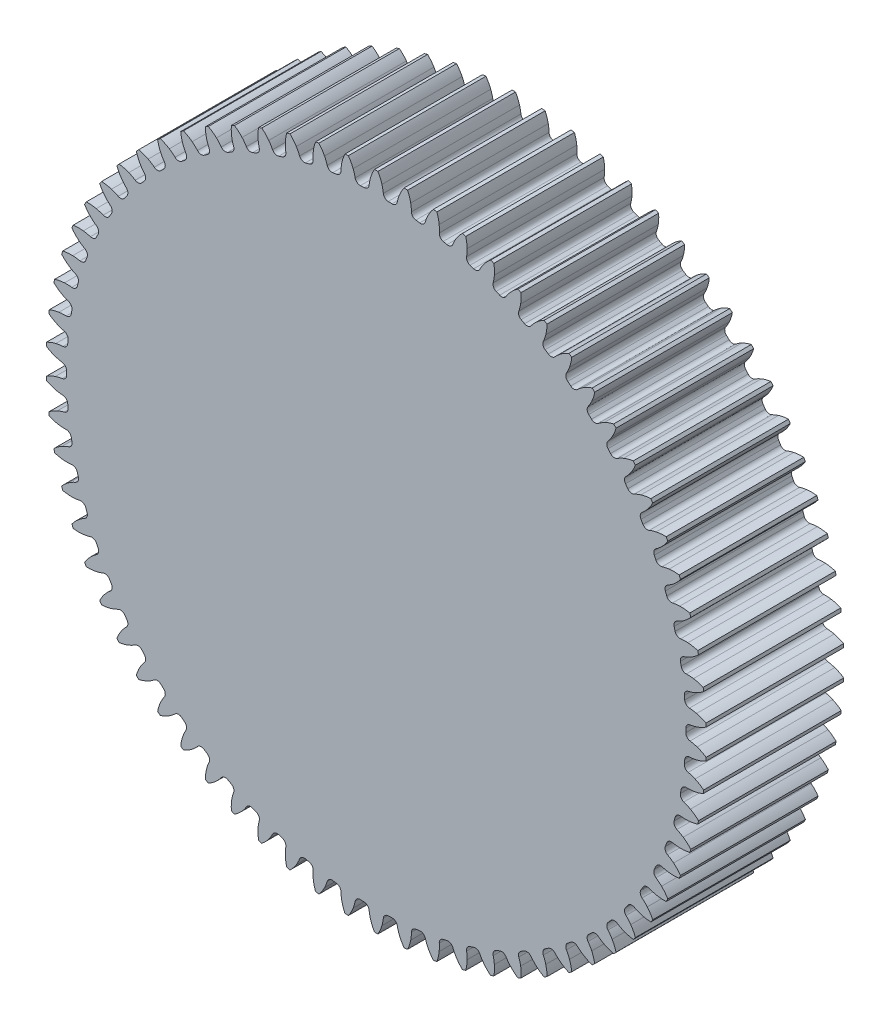
from build123d import *

# Parameters (mm, degrees)
BOSS_EXTRUDE1_DEPTH = 60


with BuildPart() as part:
    # Sketch1 → Boss-Extrude1 (new body)
    with BuildSketch(Plane.XY):
        with BuildLine():
            ThreePointArc((-5.209445207, 134.899450261), (-6.056752097, 134.864063983), (-6.903819981, 134.823355802))
            ThreePointArc((-6.903819981, 134.823355802), (-8.369677855, 135.285991471), (-9.17486238, 136.595361148))
            ThreePointArc((-9.17486238, 136.595361148), (-9.549319529, 138.136218892), (-10.057566475, 139.63826609))
            ThreePointArc((-10.057566475, 139.63826609), (-10.983932114, 141.630428056), (-12.160904684, 143.485582542))
            ThreePointArc((-12.160904684, 143.485582542), (-12.908060482, 143.420298335), (-13.654866125, 143.351123578))
            ThreePointArc((-13.654866125, 143.351123578), (-14.481673637, 141.315625621), (-15.037437945, 139.190069545))
            ThreePointArc((-15.037437945, 139.190069545), (-15.269316269, 137.621409867), (-15.362624964, 136.038452436))
            ThreePointArc((-15.362624964, 136.038452436), (-15.921072858, 134.60635362), (-17.280767005, 133.889413666))
            ThreePointArc((-17.280767005, 133.889413666), (-18.121490885, 133.778217839), (-18.96149967, 133.661742957))
            ThreePointArc((-18.96149967, 133.661742957), (-20.462926773, 133.991117704), (-21.382240854, 135.22304006))
            ThreePointArc((-21.382240854, 135.22304006), (-21.893311972, 136.724128683), (-22.534155338, 138.174570176))
            ThreePointArc((-22.534155338, 138.174570176), (-23.635367723, 140.075673508), (-24.973896913, 141.817856679))
            ThreePointArc((-24.973896913, 141.817856679), (-25.712192851, 141.685860758), (-26.449791296, 141.550021337))
            ThreePointArc((-26.449791296, 141.550021337), (-27.090809694, 139.448603242), (-27.453803281, 137.281785702))
            ThreePointArc((-27.453803281, 137.281785702), (-27.544134561, 135.698655574), (-27.495172413, 134.113706536))
            ThreePointArc((-27.495172413, 134.113706536), (-27.922999812, 132.637314046), (-29.212954228, 131.801378237))
            ThreePointArc((-29.212954228, 131.801378237), (-30.040326084, 131.615268145), (-30.866512512, 131.42396435))
            ThreePointArc((-30.866512512, 131.42396435), (-32.391420236, 131.617426243), (-33.417462097, 132.761982562))
            ThreePointArc((-33.417462097, 132.761982562), (-34.061032341, 134.211216182), (-34.829312432, 135.598373868))
            ThreePointArc((-34.829312432, 135.598373868), (-36.096505248, 137.393111999), (-37.585814009, 139.008296822))
            ThreePointArc((-37.585814009, 139.008296822), (-38.309305762, 138.81065194), (-39.0317583, 138.609241553))
            ThreePointArc((-39.0317583, 138.609241553), (-39.481826481, 136.458822704), (-39.649126735, 134.26818964))
            ThreePointArc((-39.649126735, 134.26818964), (-39.597183678, 132.683335495), (-39.4063449, 131.109155929))
            ThreePointArc((-39.4063449, 131.109155929), (-39.70010719, 129.600356809), (-40.90993592, 128.65215561))
            ThreePointArc((-40.90993592, 128.65215561), (-41.717294241, 128.3926297), (-42.523006345, 128.128037257))
            ThreePointArc((-42.523006345, 128.128037257), (-44.059117029, 128.184028656), (-45.183625585, 129.232003644))
            ThreePointArc((-45.183625585, 129.232003644), (-45.954513304, 130.617713884), (-46.844044381, 131.930419184))
            ThreePointArc((-46.844044381, 131.930419184), (-48.267014938, 133.604341939), (-49.895112231, 135.079523894))
            ThreePointArc((-49.895112231, 135.079523894), (-50.597974668, 134.817821372), (-51.299464537, 134.552461658))
            ThreePointArc((-51.299464537, 134.552461658), (-51.554958816, 132.370355962), (-51.525218735, 130.173545063))
            ThreePointArc((-51.525218735, 130.173545063), (-51.331419555, 128.599727215), (-51.00024067, 127.04899149))
            ThreePointArc((-51.00024067, 127.04899149), (-51.157572648, 125.519933702), (-52.277534863, 124.467101471))
            ThreePointArc((-52.277534863, 124.467101471), (-53.058379273, 124.136249294), (-53.837129934, 123.800498547))
            ThreePointArc((-53.837129934, 123.800498547), (-55.372075718, 123.718568641), (-56.585997087, 124.66152462))
            ThreePointArc((-56.585997087, 124.66152462), (-57.477995547, 125.972554555), (-58.48161563, 127.200238338))
            ThreePointArc((-58.48161563, 127.200238338), (-60.048907004, 128.739868276), (-61.802684347, 130.063170066))
            ThreePointArc((-61.802684347, 130.063170066), (-62.479258433, 129.739516978), (-63.154137649, 129.412344457))
            ThreePointArc((-63.154137649, 129.412344457), (-63.213000937, 127.216120946), (-62.986459969, 125.030819643))
            ThreePointArc((-62.986459969, 125.030819643), (-62.652365023, 123.480709547), (-62.183512488, 121.965903274))
            ThreePointArc((-62.183512488, 121.965903274), (-62.203147411, 120.428897894), (-63.224225834, 119.279911417))
            ThreePointArc((-63.224225834, 119.279911417), (-63.972269434, 118.880396801), (-64.717788608, 118.476191016))
            ThreePointArc((-64.717788608, 118.476191016), (-66.239211012, 118.256999456), (-67.532771413, 119.087344299))
            ThreePointArc((-67.532771413, 119.087344299), (-68.538698766, 120.313138288), (-69.648327295, 121.445915967))
            ThreePointArc((-69.648327295, 121.445915967), (-71.347320579, 122.838856891), (-73.212657588, 123.999624068))
            ThreePointArc((-73.212657588, 123.999624068), (-73.857495946, 123.616626279), (-74.500330778, 123.230275151))
            ThreePointArc((-74.500330778, 123.230275151), (-74.362089142, 121.037616526), (-73.940571263, 118.88141958))
            ThreePointArc((-73.940571263, 118.88141958), (-73.468870488, 117.367497811), (-72.866119228, 115.90081732))
            ThreePointArc((-72.866119228, 115.90081732), (-72.747899006, 114.368239411), (-73.661872514, 113.132349652))
            ThreePointArc((-73.661872514, 113.132349652), (-74.371092496, 112.667389252), (-75.077377702, 112.197982858))
            ThreePointArc((-75.077377702, 112.197982858), (-76.573027126, 111.843294446), (-77.935811571, 112.554342704))
            ThreePointArc((-77.935811571, 112.554342704), (-79.047568683, 113.685031374), (-80.254271582, 114.713782488))
            ThreePointArc((-80.254271582, 114.713782488), (-82.07128748, 115.948819258), (-84.033165558, 116.937706007))
            ThreePointArc((-84.033165558, 116.937706007), (-84.64107633, 116.49844719), (-85.24669105, 116.056028129))
            ThreePointArc((-85.24669105, 116.056028129), (-84.91245753, 113.884588387), (-84.299356554, 111.774856227))
            ThreePointArc((-84.299356554, 111.774856227), (-83.693847806, 110.309311994), (-82.96205082, 108.902566134))
            ThreePointArc((-82.96205082, 108.902566134), (-82.706927294, 107.386755112), (-83.506437109, 106.073912728))
            ThreePointArc((-83.506437109, 106.073912728), (-84.171123251, 105.547250133), (-84.832487896, 105.016422513))
            ThreePointArc((-84.832487896, 105.016422513), (-86.290322251, 104.529092992), (-87.711358401, 105.115119723))
            ThreePointArc((-87.711358401, 105.115119723), (-88.919994056, 106.141599433), (-90.214055663, 107.058041084))
            ThreePointArc((-90.214055663, 107.058041084), (-92.134464632, 108.125229909), (-94.177087891, 108.934274296))
            ThreePointArc((-94.177087891, 108.934274296), (-94.743176535, 108.442291105), (-95.30669509, 107.947366207))
            ThreePointArc((-95.30669509, 107.947366207), (-94.779160738, 105.814628506), (-93.979412993, 103.768347454))
            ThreePointArc((-93.979412993, 103.768347454), (-93.244971473, 102.362980457), (-92.39002076, 101.027495519))
            ThreePointArc((-92.39002076, 101.027495519), (-92.000048034, 99.540655803), (-92.678656973, 98.161431029))
            ThreePointArc((-92.678656973, 98.161431029), (-93.293457613, 97.577306617), (-93.904576777, 96.989331683))
            ThreePointArc((-93.904576777, 96.989331683), (-95.312858439, 96.373284743), (-96.780704946, 96.829571604))
            ThreePointArc((-96.780704946, 96.829571604), (-98.076487921, 97.743577744), (-99.447489213, 98.540331282))
            ThreePointArc((-99.447489213, 98.540331282), (-101.455829249, 99.431079786), (-103.562751686, 100.053767861))
            ThreePointArc((-103.562751686, 100.053767861), (-104.082460391, 99.513021454), (-104.59934566, 98.969575565))
            ThreePointArc((-104.59934566, 98.969575565), (-103.882757873, 96.892711453), (-102.902802458, 94.926356963))
            ThreePointArc((-102.902802458, 94.926356963), (-102.045341457, 93.592482391), (-101.074120578, 92.339010913))
            ThreePointArc((-101.074120578, 92.339010913), (-100.552438482, 90.893113662), (-101.104682786, 89.458611205))
            ThreePointArc((-101.104682786, 89.458611205), (-101.66464791, 88.821728002), (-102.220601222, 88.181339783))
            ThreePointArc((-102.220601222, 88.181339783), (-103.567991533, 87.441535471), (-105.070830161, 87.76440871))
            ThreePointArc((-105.070830161, 87.76440871), (-106.443327574, 88.558582239), (-107.880230054, 89.229232674))
            ThreePointArc((-107.880230054, 89.229232674), (-109.960331183, 89.936369073), (-112.114589099, 90.367687318))
            ThreePointArc((-112.114589099, 90.367687318), (-112.583733475, 89.782531468), (-113.049823802, 89.194940094))
            ThreePointArc((-113.049823802, 89.194940094), (-112.149952123, 87.19067126), (-110.997679063, 85.320075261))
            ThreePointArc((-110.997679063, 85.320075261), (-110.024102354, 84.068432687), (-108.944431006, 82.907066886))
            ThreePointArc((-108.944431006, 82.907066886), (-108.295239819, 81.513753615), (-108.716673141, 80.035523245))
            ThreePointArc((-108.716673141, 80.035523245), (-109.217294241, 79.351009059), (-109.71360549, 78.663363584))
            ThreePointArc((-109.71360549, 78.663363584), (-110.989256057, 77.805758371), (-112.514986832, 77.992618401))
            ThreePointArc((-112.514986832, 77.992618401), (-113.95314814, 78.660565102), (-115.444382715, 79.19971275))
            ThreePointArc((-115.444382715, 79.19971275), (-117.579497187, 79.717543598), (-119.763745763, 79.954019291))
            ThreePointArc((-119.763745763, 79.954019291), (-120.178548536, 79.329165329), (-120.590091235, 78.702159411))
            ThreePointArc((-120.590091235, 78.702159411), (-119.514180902, 76.78662305), (-118.198867622, 75.026846481))
            ThreePointArc((-118.198867622, 75.026846481), (-117.117013871, 73.867513395), (-115.937584935, 72.807603905))
            ThreePointArc((-115.937584935, 72.807603905), (-115.166111562, 71.478092752), (-115.453340769, 69.968036312))
            ThreePointArc((-115.453340769, 69.968036312), (-115.890587136, 69.24140245), (-116.323260317, 68.512036236))
            ThreePointArc((-116.323260317, 68.512036236), (-117.516900351, 67.543535054), (-119.053238987, 67.592877388))
            ThreePointArc((-119.053238987, 67.592877388), (-120.545484961, 68.129219346), (-122.079045086, 68.532523307))
            ThreePointArc((-122.079045086, 68.532523307), (-124.251982214, 68.856879335), (-126.448635166, 68.896608514))
            ThreePointArc((-126.448635166, 68.896608514), (-126.805756587, 68.237087396), (-127.159438159, 67.575715216))
            ThreePointArc((-127.159438159, 67.575715216), (-125.916151769, 65.7643341), (-124.448388399, 64.129545648))
            ThreePointArc((-124.448388399, 64.129545648), (-123.266968056, 63.071856319), (-121.9972776, 62.121936907))
            ThreePointArc((-121.9972776, 62.121936907), (-121.109733491, 60.866932316), (-121.260445982, 59.337207891))
            ThreePointArc((-121.260445982, 59.337207891), (-121.630797167, 58.574304781), (-121.996348649, 57.809090256))
            ThreePointArc((-121.996348649, 57.809090256), (-123.098367663, 56.737490908), (-124.632944464, 56.64891827))
            ThreePointArc((-124.632944464, 56.64891827), (-126.167260417, 57.049337175), (-127.730798768, 57.313550283))
            ThreePointArc((-127.730798768, 57.313550283), (-129.92406334, 57.441819967), (-132.115434509, 57.284482755))
            ThreePointArc((-132.115434509, 57.284482755), (-132.411999247, 56.595604558), (-132.704972056, 55.905191097))
            ThreePointArc((-132.704972056, 55.905191097), (-131.30431982, 54.212549401), (-129.695923926, 52.715911421))
            ThreePointArc((-129.695923926, 52.715911421), (-128.424449094, 51.768381741), (-127.074719919, 50.9361006))
            ThreePointArc((-127.074719919, 50.9361006), (-126.078251058, 49.765707129), (-126.091233384, 48.228631162))
            ThreePointArc((-126.091233384, 48.228631162), (-126.391707536, 47.435601251), (-126.687194115, 46.640699472))
            ThreePointArc((-126.687194115, 46.640699472), (-127.688719299, 45.474629845), (-129.209178755, 45.248855371))
            ThreePointArc((-129.209178755, 45.248855371), (-130.773211277, 45.510127286), (-132.354139163, 45.633122252))
            ThreePointArc((-132.354139163, 45.633122252), (-134.550072302, 45.56427284), (-136.718518056, 45.211136024))
            ThreePointArc((-136.718518056, 45.211136024), (-136.952138347, 44.49844719), (-137.182043547, 43.78455125))
            ThreePointArc((-137.182043547, 43.78455125), (-135.635302694, 42.224277131), (-133.899224135, 40.877839671))
            ThreePointArc((-133.899224135, 40.877839671), (-132.547931981, 40.048098593), (-131.129031312, 39.340156761))
            ThreePointArc((-131.129031312, 39.340156761), (-130.031660679, 38.26379773), (-129.906808315, 36.731745852))
            ThreePointArc((-129.906808315, 36.731745852), (-130.134986194, 35.914974152), (-130.358028784, 35.096785201))
            ThreePointArc((-130.358028784, 35.096785201), (-131.250996447, 33.845633802), (-132.745096712, 33.484475295))
            ThreePointArc((-132.745096712, 33.484475295), (-134.326253133, 33.604496612), (-135.911841852, 33.585283153))
            ThreePointArc((-135.911841852, 33.585283153), (-138.092763196, 33.319868979), (-140.220824485, 32.77377581))
            ThreePointArc((-140.220824485, 32.77377581), (-140.389619354, 32.04301449), (-140.554605886, 31.311383941))
            ThreePointArc((-140.554605886, 31.311383941), (-138.874229862, 29.896039808), (-137.024446521, 28.710643592))
            ThreePointArc((-137.024446521, 28.710643592), (-135.604216856, 28.005371702), (-134.127568848, 27.427469112))
            ThreePointArc((-134.127568848, 27.427469112), (-132.938131827, 26.453810731), (-132.67645001, 24.939118123))
            ThreePointArc((-132.67645001, 24.939118123), (-132.830494461, 24.105180798), (-132.979297255, 23.270292252))
            ThreePointArc((-132.979297255, 23.270292252), (-133.756517746, 21.944132616), (-135.212229204, 21.450497912))
            ThreePointArc((-135.212229204, 21.450497912), (-136.797778981, 21.428302289), (-138.375262305, 21.267035102))
            ThreePointArc((-138.375262305, 21.267035102), (-140.523612358, 20.807193125), (-142.594155283, 20.072540423))
            ThreePointArc((-142.594155283, 20.072540423), (-142.696765695, 19.329590278), (-142.795505182, 18.58611578))
            ThreePointArc((-142.795505182, 18.58611578), (-140.995023388, 17.327097152), (-139.046428634, 16.312286293))
            ThreePointArc((-139.046428634, 16.312286293), (-137.568696311, 15.737162026), (-136.046190065, 15.293951609))
            ThreePointArc((-136.046190065, 15.293951609), (-134.774263303, 14.430833203), (-134.377858942, 12.945695279))
            ThreePointArc((-134.377858942, 12.945695279), (-134.456529689, 12.101306702), (-134.529894615, 11.256440592))
            ThreePointArc((-134.529894615, 11.256440592), (-135.185110211, 9.865950178), (-136.590712329, 9.243813733))
            ThreePointArc((-136.590712329, 9.243813733), (-138.167889549, 9.079579877), (-139.72456651, 8.777557388))
            ThreePointArc((-139.72456651, 8.777557388), (-141.82304802, 8.126989986), (-143.819401788, 7.209692743))
            ThreePointArc((-143.819401788, 7.209692743), (-143.855001582, 6.46053557), (-143.886699033, 5.711203143))
            ThreePointArc((-143.886699033, 5.711203143), (-141.98060789, 4.618646898), (-139.948890661, 3.782592056))
            ThreePointArc((-139.948890661, 3.782592056), (-138.425553512, 3.342245974), (-136.869447353, 3.037296199))
            ThreePointArc((-136.869447353, 3.037296199), (-135.525271657, 2.29166709), (-134.997336366, 0.848041308))
            ThreePointArc((-134.997336366, 0.848041308), (-135, 0), (-134.997336366, -0.848041308))
            ThreePointArc((-134.997336366, -0.848041308), (-135.525271657, -2.29166709), (-136.869447353, -3.037296199))
            ThreePointArc((-136.869447353, -3.037296199), (-138.425553512, -3.342245974), (-139.948890661, -3.782592056))
            ThreePointArc((-139.948890661, -3.782592056), (-141.98060789, -4.618646898), (-143.886699033, -5.711203143))
            ThreePointArc((-143.886699033, -5.711203143), (-143.855001582, -6.46053557), (-143.819401788, -7.209692743))
            ThreePointArc((-143.819401788, -7.209692743), (-141.82304802, -8.126989986), (-139.72456651, -8.777557388))
            ThreePointArc((-139.72456651, -8.777557388), (-138.167889549, -9.079579877), (-136.590712329, -9.243813733))
            ThreePointArc((-136.590712329, -9.243813733), (-135.185110211, -9.865950178), (-134.529894615, -11.256440592))
            ThreePointArc((-134.529894615, -11.256440592), (-134.456529689, -12.101306702), (-134.377858942, -12.945695279))
            ThreePointArc((-134.377858942, -12.945695279), (-134.774263303, -14.430833203), (-136.046190065, -15.293951609))
            ThreePointArc((-136.046190065, -15.293951609), (-137.568696311, -15.737162026), (-139.046428634, -16.312286293))
            ThreePointArc((-139.046428634, -16.312286293), (-140.995023388, -17.327097152), (-142.795505182, -18.58611578))
            ThreePointArc((-142.795505182, -18.58611578), (-142.696765695, -19.329590278), (-142.594155283, -20.072540423))
            ThreePointArc((-142.594155283, -20.072540423), (-140.523612358, -20.807193125), (-138.375262305, -21.267035102))
            ThreePointArc((-138.375262305, -21.267035102), (-136.797778981, -21.428302289), (-135.212229204, -21.450497912))
            ThreePointArc((-135.212229204, -21.450497912), (-133.756517746, -21.944132616), (-132.979297255, -23.270292252))
            ThreePointArc((-132.979297255, -23.270292252), (-132.830494461, -24.105180798), (-132.67645001, -24.939118123))
            ThreePointArc((-132.67645001, -24.939118123), (-132.938131827, -26.453810731), (-134.127568848, -27.427469112))
            ThreePointArc((-134.127568848, -27.427469112), (-135.604216856, -28.005371702), (-137.024446521, -28.710643592))
            ThreePointArc((-137.024446521, -28.710643592), (-138.874229862, -29.896039808), (-140.554605886, -31.311383941))
            ThreePointArc((-140.554605886, -31.311383941), (-140.389619354, -32.04301449), (-140.220824485, -32.77377581))
            ThreePointArc((-140.220824485, -32.77377581), (-138.092763196, -33.319868979), (-135.911841852, -33.585283153))
            ThreePointArc((-135.911841852, -33.585283153), (-134.326253133, -33.604496612), (-132.745096712, -33.484475295))
            ThreePointArc((-132.745096712, -33.484475295), (-131.250996447, -33.845633802), (-130.358028784, -35.096785201))
            ThreePointArc((-130.358028784, -35.096785201), (-130.134986194, -35.914974151), (-129.906808315, -36.731745852))
            ThreePointArc((-129.906808315, -36.731745852), (-130.031660679, -38.26379773), (-131.129031312, -39.340156761))
            ThreePointArc((-131.129031312, -39.340156761), (-132.547931981, -40.048098593), (-133.899224135, -40.877839671))
            ThreePointArc((-133.899224135, -40.877839671), (-135.635302694, -42.224277131), (-137.182043547, -43.78455125))
            ThreePointArc((-137.182043547, -43.78455125), (-136.952138347, -44.49844719), (-136.718518056, -45.211136024))
            ThreePointArc((-136.718518056, -45.211136024), (-134.550072302, -45.56427284), (-132.354139163, -45.633122252))
            ThreePointArc((-132.354139163, -45.633122252), (-130.773211277, -45.510127286), (-129.209178755, -45.248855371))
            ThreePointArc((-129.209178755, -45.248855371), (-127.688719299, -45.474629845), (-126.687194115, -46.640699472))
            ThreePointArc((-126.687194115, -46.640699472), (-126.391707536, -47.435601251), (-126.091233384, -48.228631162))
            ThreePointArc((-126.091233384, -48.228631162), (-126.078251058, -49.765707129), (-127.074719919, -50.9361006))
            ThreePointArc((-127.074719919, -50.9361006), (-128.424449094, -51.768381741), (-129.695923926, -52.715911421))
            ThreePointArc((-129.695923926, -52.715911421), (-131.30431982, -54.212549401), (-132.704972056, -55.905191097))
            ThreePointArc((-132.704972056, -55.905191097), (-132.411999247, -56.595604558), (-132.115434509, -57.284482755))
            ThreePointArc((-132.115434509, -57.284482755), (-129.92406334, -57.441819967), (-127.730798768, -57.313550283))
            ThreePointArc((-127.730798768, -57.313550283), (-126.167260417, -57.049337175), (-124.632944464, -56.64891827))
            ThreePointArc((-124.632944464, -56.64891827), (-123.098367663, -56.737490908), (-121.996348649, -57.809090256))
            ThreePointArc((-121.996348649, -57.809090256), (-121.630797167, -58.574304781), (-121.260445982, -59.337207891))
            ThreePointArc((-121.260445982, -59.337207891), (-121.109733491, -60.866932315), (-121.9972776, -62.121936907))
            ThreePointArc((-121.9972776, -62.121936907), (-123.266968056, -63.071856319), (-124.448388399, -64.129545648))
            ThreePointArc((-124.448388399, -64.129545648), (-125.916151769, -65.7643341), (-127.159438159, -67.575715216))
            ThreePointArc((-127.159438159, -67.575715216), (-126.805756587, -68.237087396), (-126.448635166, -68.896608514))
            ThreePointArc((-126.448635166, -68.896608514), (-124.251982214, -68.856879335), (-122.079045086, -68.532523307))
            ThreePointArc((-122.079045086, -68.532523307), (-120.545484961, -68.129219346), (-119.053238987, -67.592877388))
            ThreePointArc((-119.053238987, -67.592877388), (-117.516900351, -67.543535054), (-116.323260317, -68.512036236))
            ThreePointArc((-116.323260317, -68.512036236), (-115.890587136, -69.24140245), (-115.453340769, -69.968036312))
            ThreePointArc((-115.453340769, -69.968036312), (-115.166111562, -71.478092752), (-115.937584935, -72.807603904))
            ThreePointArc((-115.937584935, -72.807603904), (-117.117013871, -73.867513395), (-118.198867622, -75.026846481))
            ThreePointArc((-118.198867622, -75.026846481), (-119.514180902, -76.78662305), (-120.590091235, -78.702159411))
            ThreePointArc((-120.590091235, -78.702159411), (-120.178548536, -79.329165329), (-119.763745763, -79.954019291))
            ThreePointArc((-119.763745763, -79.954019291), (-117.579497187, -79.717543598), (-115.444382715, -79.19971275))
            ThreePointArc((-115.444382715, -79.19971275), (-113.95314814, -78.660565102), (-112.514986832, -77.992618401))
            ThreePointArc((-112.514986832, -77.992618401), (-110.989256057, -77.805758371), (-109.71360549, -78.663363584))
            ThreePointArc((-109.71360549, -78.663363584), (-109.217294241, -79.351009059), (-108.716673141, -80.035523245))
            ThreePointArc((-108.716673141, -80.035523245), (-108.295239819, -81.513753615), (-108.944431006, -82.907066886))
            ThreePointArc((-108.944431006, -82.907066886), (-110.024102354, -84.068432687), (-110.997679063, -85.320075261))
            ThreePointArc((-110.997679063, -85.320075261), (-112.149952123, -87.19067126), (-113.049823802, -89.194940094))
            ThreePointArc((-113.049823802, -89.194940094), (-112.583733475, -89.782531468), (-112.114589099, -90.367687318))
            ThreePointArc((-112.114589099, -90.367687318), (-109.960331183, -89.936369073), (-107.880230054, -89.229232674))
            ThreePointArc((-107.880230054, -89.229232674), (-106.443327574, -88.558582239), (-105.070830161, -87.76440871))
            ThreePointArc((-105.070830161, -87.76440871), (-103.567991533, -87.441535471), (-102.220601222, -88.181339783))
            ThreePointArc((-102.220601222, -88.181339783), (-101.66464791, -88.821728002), (-101.104682786, -89.458611205))
            ThreePointArc((-101.104682786, -89.458611205), (-100.552438482, -90.893113662), (-101.074120578, -92.339010913))
            ThreePointArc((-101.074120578, -92.339010913), (-102.045341457, -93.592482391), (-102.902802458, -94.926356963))
            ThreePointArc((-102.902802458, -94.926356963), (-103.882757873, -96.892711453), (-104.59934566, -98.969575565))
            ThreePointArc((-104.59934566, -98.969575565), (-104.082460391, -99.513021454), (-103.562751686, -100.053767861))
            ThreePointArc((-103.562751686, -100.053767861), (-101.455829249, -99.431079786), (-99.447489213, -98.540331282))
            ThreePointArc((-99.447489213, -98.540331282), (-98.076487921, -97.743577744), (-96.780704946, -96.829571604))
            ThreePointArc((-96.780704946, -96.829571604), (-95.312858439, -96.373284743), (-93.904576777, -96.989331683))
            ThreePointArc((-93.904576777, -96.989331683), (-93.293457613, -97.577306617), (-92.678656973, -98.161431029))
            ThreePointArc((-92.678656973, -98.161431029), (-92.000048034, -99.540655803), (-92.39002076, -101.027495519))
            ThreePointArc((-92.39002076, -101.027495519), (-93.244971473, -102.362980457), (-93.979412993, -103.768347454))
            ThreePointArc((-93.979412993, -103.768347454), (-94.779160738, -105.814628506), (-95.30669509, -107.947366207))
            ThreePointArc((-95.30669509, -107.947366207), (-94.743176535, -108.442291105), (-94.177087891, -108.934274296))
            ThreePointArc((-94.177087891, -108.934274296), (-92.134464632, -108.125229909), (-90.214055663, -107.058041084))
            ThreePointArc((-90.214055663, -107.058041084), (-88.919994056, -106.141599433), (-87.711358401, -105.115119723))
            ThreePointArc((-87.711358401, -105.115119723), (-86.290322251, -104.529092992), (-84.832487896, -105.016422513))
            ThreePointArc((-84.832487896, -105.016422513), (-84.171123251, -105.547250133), (-83.506437109, -106.073912728))
            ThreePointArc((-83.506437109, -106.073912728), (-82.706927294, -107.386755112), (-82.96205082, -108.902566134))
            ThreePointArc((-82.96205082, -108.902566134), (-83.693847806, -110.309311994), (-84.299356554, -111.774856227))
            ThreePointArc((-84.299356554, -111.774856227), (-84.91245753, -113.884588387), (-85.24669105, -116.056028129))
            ThreePointArc((-85.24669105, -116.056028129), (-84.64107633, -116.49844719), (-84.033165558, -116.937706007))
            ThreePointArc((-84.033165558, -116.937706007), (-82.07128748, -115.948819258), (-80.254271582, -114.713782488))
            ThreePointArc((-80.254271582, -114.713782488), (-79.047568683, -113.685031374), (-77.935811571, -112.554342704))
            ThreePointArc((-77.935811571, -112.554342704), (-76.573027126, -111.843294446), (-75.077377702, -112.197982858))
            ThreePointArc((-75.077377702, -112.197982858), (-74.371092496, -112.667389252), (-73.661872514, -113.132349652))
            ThreePointArc((-73.661872514, -113.132349652), (-72.747899006, -114.368239411), (-72.866119228, -115.90081732))
            ThreePointArc((-72.866119228, -115.90081732), (-73.468870488, -117.367497811), (-73.940571263, -118.88141958))
            ThreePointArc((-73.940571263, -118.88141958), (-74.362089142, -121.037616526), (-74.500330778, -123.230275151))
            ThreePointArc((-74.500330778, -123.230275151), (-73.857495946, -123.616626279), (-73.212657588, -123.999624068))
            ThreePointArc((-73.212657588, -123.999624068), (-71.347320579, -122.838856891), (-69.648327295, -121.445915967))
            ThreePointArc((-69.648327295, -121.445915967), (-68.538698766, -120.313138288), (-67.532771413, -119.087344299))
            ThreePointArc((-67.532771413, -119.087344299), (-66.239211012, -118.256999456), (-64.717788608, -118.476191016))
            ThreePointArc((-64.717788608, -118.476191016), (-63.972269434, -118.880396801), (-63.224225834, -119.279911417))
            ThreePointArc((-63.224225834, -119.279911417), (-62.203147411, -120.428897894), (-62.183512488, -121.965903274))
            ThreePointArc((-62.183512488, -121.965903274), (-62.652365023, -123.480709547), (-62.986459969, -125.030819643))
            ThreePointArc((-62.986459969, -125.030819643), (-63.213000937, -127.216120946), (-63.154137649, -129.412344457))
            ThreePointArc((-63.154137649, -129.412344457), (-62.479258433, -129.739516978), (-61.802684347, -130.063170066))
            ThreePointArc((-61.802684347, -130.063170066), (-60.048907004, -128.739868276), (-58.48161563, -127.200238338))
            ThreePointArc((-58.48161563, -127.200238338), (-57.477995547, -125.972554555), (-56.585997087, -124.66152462))
            ThreePointArc((-56.585997087, -124.66152462), (-55.372075718, -123.718568641), (-53.837129934, -123.800498547))
            ThreePointArc((-53.837129934, -123.800498547), (-53.058379273, -124.136249294), (-52.277534863, -124.467101471))
            ThreePointArc((-52.277534863, -124.467101471), (-51.157572648, -125.519933702), (-51.00024067, -127.04899149))
            ThreePointArc((-51.00024067, -127.04899149), (-51.331419555, -128.599727215), (-51.525218735, -130.173545063))
            ThreePointArc((-51.525218735, -130.173545063), (-51.554958816, -132.370355962), (-51.299464537, -134.552461658))
            ThreePointArc((-51.299464537, -134.552461658), (-50.597974668, -134.817821372), (-49.895112231, -135.079523894))
            ThreePointArc((-49.895112231, -135.079523894), (-48.267014938, -133.604341939), (-46.844044381, -131.930419184))
            ThreePointArc((-46.844044381, -131.930419184), (-45.954513304, -130.617713884), (-45.183625585, -129.232003644))
            ThreePointArc((-45.183625585, -129.232003644), (-44.059117029, -128.184028656), (-42.523006345, -128.128037257))
            ThreePointArc((-42.523006345, -128.128037257), (-41.717294241, -128.3926297), (-40.90993592, -128.65215561))
            ThreePointArc((-40.90993592, -128.65215561), (-39.70010719, -129.600356809), (-39.4063449, -131.109155929))
            ThreePointArc((-39.4063449, -131.109155929), (-39.597183678, -132.683335495), (-39.649126735, -134.26818964))
            ThreePointArc((-39.649126735, -134.26818964), (-39.481826481, -136.458822704), (-39.0317583, -138.609241553))
            ThreePointArc((-39.0317583, -138.609241553), (-38.309305762, -138.81065194), (-37.585814009, -139.008296822))
            ThreePointArc((-37.585814009, -139.008296822), (-36.096505248, -137.393111999), (-34.829312432, -135.598373868))
            ThreePointArc((-34.829312432, -135.598373868), (-34.061032341, -134.211216182), (-33.417462097, -132.761982562))
            ThreePointArc((-33.417462097, -132.761982562), (-32.391420236, -131.617426243), (-30.866512512, -131.42396435))
            ThreePointArc((-30.866512512, -131.42396435), (-30.040326084, -131.615268145), (-29.212954228, -131.801378237))
            ThreePointArc((-29.212954228, -131.801378237), (-27.922999812, -132.637314046), (-27.495172413, -134.113706536))
            ThreePointArc((-27.495172413, -134.113706536), (-27.544134561, -135.698655574), (-27.453803281, -137.281785702))
            ThreePointArc((-27.453803281, -137.281785702), (-27.090809694, -139.448603242), (-26.449791296, -141.550021337))
            ThreePointArc((-26.449791296, -141.550021337), (-25.712192851, -141.685860758), (-24.973896913, -141.817856679))
            ThreePointArc((-24.973896913, -141.817856679), (-23.635367723, -140.075673508), (-22.534155338, -138.174570176))
            ThreePointArc((-22.534155338, -138.174570176), (-21.893311972, -136.724128683), (-21.382240854, -135.22304006))
            ThreePointArc((-21.382240854, -135.22304006), (-20.462926773, -133.991117704), (-18.96149967, -133.661742957))
            ThreePointArc((-18.96149967, -133.661742957), (-18.121490885, -133.778217839), (-17.280767005, -133.889413666))
            ThreePointArc((-17.280767005, -133.889413666), (-15.921072858, -134.60635362), (-15.362624964, -136.038452436))
            ThreePointArc((-15.362624964, -136.038452436), (-15.269316269, -137.621409867), (-15.037437945, -139.190069545))
            ThreePointArc((-15.037437945, -139.190069545), (-14.481673637, -141.315625621), (-13.654866125, -143.351123578))
            ThreePointArc((-13.654866125, -143.351123578), (-12.908060482, -143.420298335), (-12.160904684, -143.485582542))
            ThreePointArc((-12.160904684, -143.485582542), (-10.983932114, -141.630428056), (-10.057566475, -139.63826609))
            ThreePointArc((-10.057566475, -139.63826609), (-9.549319529, -138.136218892), (-9.17486238, -136.595361148))
            ThreePointArc((-9.17486238, -136.595361148), (-8.369677855, -135.285991471), (-6.903819981, -134.823355802))
            ThreePointArc((-6.903819981, -134.823355802), (-6.056752097, -134.864063983), (-5.209445207, -134.899450261))
            ThreePointArc((-5.209445207, -134.899450261), (-3.790958787, -135.491621982), (-3.106386691, -136.867896706))
            ThreePointArc((-3.106386691, -136.867896706), (-2.871558419, -138.436117489), (-2.5, -139.977676792))
            ThreePointArc((-2.5, -139.977676792), (-1.755939659, -142.044857675), (-0.75, -143.998046862))
            ThreePointArc((-0.75, -143.998046862), (0, -144), (0.75, -143.998046862))
            ThreePointArc((0.75, -143.998046862), (1.755939659, -142.044857675), (2.5, -139.977676792))
            ThreePointArc((2.5, -139.977676792), (2.871558419, -138.436117489), (3.106386691, -136.867896706))
            ThreePointArc((3.106386691, -136.867896706), (3.790958787, -135.491621982), (5.209445207, -134.899450261))
            ThreePointArc((5.209445207, -134.899450261), (6.056752097, -134.864063983), (6.903819981, -134.823355802))
            ThreePointArc((6.903819981, -134.823355802), (8.369677855, -135.285991471), (9.17486238, -136.595361148))
            ThreePointArc((9.17486238, -136.595361148), (9.549319529, -138.136218892), (10.057566475, -139.63826609))
            ThreePointArc((10.057566475, -139.63826609), (10.983932114, -141.630428056), (12.160904684, -143.485582542))
            ThreePointArc((12.160904684, -143.485582542), (12.908060482, -143.420298335), (13.654866125, -143.351123578))
            ThreePointArc((13.654866125, -143.351123578), (14.481673637, -141.315625621), (15.037437945, -139.190069545))
            ThreePointArc((15.037437945, -139.190069545), (15.269316269, -137.621409867), (15.362624964, -136.038452436))
            ThreePointArc((15.362624964, -136.038452436), (15.921072858, -134.60635362), (17.280767005, -133.889413666))
            ThreePointArc((17.280767005, -133.889413666), (18.121490885, -133.778217839), (18.96149967, -133.661742957))
            ThreePointArc((18.96149967, -133.661742957), (20.462926773, -133.991117704), (21.382240854, -135.22304006))
            ThreePointArc((21.382240854, -135.22304006), (21.893311972, -136.724128683), (22.534155338, -138.174570176))
            ThreePointArc((22.534155338, -138.174570176), (23.635367723, -140.075673508), (24.973896913, -141.817856679))
            ThreePointArc((24.973896913, -141.817856679), (25.712192851, -141.685860758), (26.449791296, -141.550021337))
            ThreePointArc((26.449791296, -141.550021337), (27.090809694, -139.448603242), (27.453803281, -137.281785702))
            ThreePointArc((27.453803281, -137.281785702), (27.544134561, -135.698655574), (27.495172413, -134.113706536))
            ThreePointArc((27.495172413, -134.113706536), (27.922999812, -132.637314046), (29.212954228, -131.801378237))
            ThreePointArc((29.212954228, -131.801378237), (30.040326084, -131.615268145), (30.866512512, -131.42396435))
            ThreePointArc((30.866512512, -131.42396435), (32.391420236, -131.617426243), (33.417462097, -132.761982562))
            ThreePointArc((33.417462097, -132.761982562), (34.061032341, -134.211216182), (34.829312432, -135.598373868))
            ThreePointArc((34.829312432, -135.598373868), (36.096505248, -137.393111999), (37.585814009, -139.008296822))
            ThreePointArc((37.585814009, -139.008296822), (38.309305762, -138.81065194), (39.0317583, -138.609241553))
            ThreePointArc((39.0317583, -138.609241553), (39.481826481, -136.458822704), (39.649126735, -134.26818964))
            ThreePointArc((39.649126735, -134.26818964), (39.597183678, -132.683335495), (39.4063449, -131.109155929))
            ThreePointArc((39.4063449, -131.109155929), (39.70010719, -129.600356809), (40.90993592, -128.65215561))
            ThreePointArc((40.90993592, -128.65215561), (41.717294241, -128.3926297), (42.523006345, -128.128037257))
            ThreePointArc((42.523006345, -128.128037257), (44.059117029, -128.184028656), (45.183625585, -129.232003644))
            ThreePointArc((45.183625585, -129.232003644), (45.954513304, -130.617713884), (46.844044381, -131.930419184))
            ThreePointArc((46.844044381, -131.930419184), (48.267014938, -133.604341939), (49.895112231, -135.079523894))
            ThreePointArc((49.895112231, -135.079523894), (50.597974668, -134.817821372), (51.299464537, -134.552461658))
            ThreePointArc((51.299464537, -134.552461658), (51.554958816, -132.370355962), (51.525218735, -130.173545063))
            ThreePointArc((51.525218735, -130.173545063), (51.331419555, -128.599727215), (51.00024067, -127.04899149))
            ThreePointArc((51.00024067, -127.04899149), (51.157572648, -125.519933702), (52.277534863, -124.467101471))
            ThreePointArc((52.277534863, -124.467101471), (53.058379273, -124.136249294), (53.837129934, -123.800498547))
            ThreePointArc((53.837129934, -123.800498547), (55.372075718, -123.718568641), (56.585997087, -124.66152462))
            ThreePointArc((56.585997087, -124.66152462), (57.477995547, -125.972554555), (58.48161563, -127.200238338))
            ThreePointArc((58.48161563, -127.200238338), (60.048907004, -128.739868276), (61.802684347, -130.063170066))
            ThreePointArc((61.802684347, -130.063170066), (62.479258433, -129.739516978), (63.154137649, -129.412344457))
            ThreePointArc((63.154137649, -129.412344457), (63.213000937, -127.216120946), (62.986459969, -125.030819643))
            ThreePointArc((62.986459969, -125.030819643), (62.652365023, -123.480709547), (62.183512488, -121.965903274))
            ThreePointArc((62.183512488, -121.965903274), (62.203147411, -120.428897894), (63.224225834, -119.279911417))
            ThreePointArc((63.224225834, -119.279911417), (63.972269434, -118.880396801), (64.717788608, -118.476191016))
            ThreePointArc((64.717788608, -118.476191016), (66.239211012, -118.256999456), (67.532771413, -119.087344299))
            ThreePointArc((67.532771413, -119.087344299), (68.538698766, -120.313138288), (69.648327295, -121.445915967))
            ThreePointArc((69.648327295, -121.445915967), (71.347320579, -122.838856891), (73.212657588, -123.999624068))
            ThreePointArc((73.212657588, -123.999624068), (73.857495946, -123.616626279), (74.500330778, -123.230275151))
            ThreePointArc((74.500330778, -123.230275151), (74.362089142, -121.037616526), (73.940571263, -118.88141958))
            ThreePointArc((73.940571263, -118.88141958), (73.468870488, -117.367497811), (72.866119228, -115.90081732))
            ThreePointArc((72.866119228, -115.90081732), (72.747899006, -114.368239411), (73.661872514, -113.132349652))
            ThreePointArc((73.661872514, -113.132349652), (74.371092496, -112.667389252), (75.077377702, -112.197982858))
            ThreePointArc((75.077377702, -112.197982858), (76.573027126, -111.843294446), (77.935811571, -112.554342704))
            ThreePointArc((77.935811571, -112.554342704), (79.047568683, -113.685031374), (80.254271582, -114.713782488))
            ThreePointArc((80.254271582, -114.713782488), (82.07128748, -115.948819258), (84.033165558, -116.937706007))
            ThreePointArc((84.033165558, -116.937706007), (84.64107633, -116.49844719), (85.24669105, -116.056028129))
            ThreePointArc((85.24669105, -116.056028129), (84.91245753, -113.884588387), (84.299356554, -111.774856227))
            ThreePointArc((84.299356554, -111.774856227), (83.693847806, -110.309311994), (82.96205082, -108.902566134))
            ThreePointArc((82.96205082, -108.902566134), (82.706927294, -107.386755112), (83.506437109, -106.073912728))
            ThreePointArc((83.506437109, -106.073912728), (84.171123251, -105.547250133), (84.832487896, -105.016422513))
            ThreePointArc((84.832487896, -105.016422513), (86.290322251, -104.529092992), (87.711358401, -105.115119723))
            ThreePointArc((87.711358401, -105.115119723), (88.919994056, -106.141599433), (90.214055663, -107.058041084))
            ThreePointArc((90.214055663, -107.058041084), (92.134464632, -108.125229909), (94.177087891, -108.934274296))
            ThreePointArc((94.177087891, -108.934274296), (94.743176535, -108.442291105), (95.30669509, -107.947366207))
            ThreePointArc((95.30669509, -107.947366207), (94.779160738, -105.814628506), (93.979412993, -103.768347454))
            ThreePointArc((93.979412993, -103.768347454), (93.244971473, -102.362980457), (92.39002076, -101.027495519))
            ThreePointArc((92.39002076, -101.027495519), (92.000048034, -99.540655803), (92.678656973, -98.161431029))
            ThreePointArc((92.678656973, -98.161431029), (93.293457613, -97.577306617), (93.904576777, -96.989331683))
            ThreePointArc((93.904576777, -96.989331683), (95.312858439, -96.373284743), (96.780704946, -96.829571604))
            ThreePointArc((96.780704946, -96.829571604), (98.076487921, -97.743577744), (99.447489213, -98.540331282))
            ThreePointArc((99.447489213, -98.540331282), (101.455829249, -99.431079786), (103.562751686, -100.053767861))
            ThreePointArc((103.562751686, -100.053767861), (104.082460391, -99.513021454), (104.59934566, -98.969575565))
            ThreePointArc((104.59934566, -98.969575565), (103.882757873, -96.892711453), (102.902802458, -94.926356963))
            ThreePointArc((102.902802458, -94.926356963), (102.045341457, -93.592482391), (101.074120578, -92.339010913))
            ThreePointArc((101.074120578, -92.339010913), (100.552438482, -90.893113662), (101.104682786, -89.458611205))
            ThreePointArc((101.104682786, -89.458611205), (101.66464791, -88.821728002), (102.220601222, -88.181339783))
            ThreePointArc((102.220601222, -88.181339783), (103.567991533, -87.441535471), (105.070830161, -87.76440871))
            ThreePointArc((105.070830161, -87.76440871), (106.443327574, -88.558582239), (107.880230054, -89.229232674))
            ThreePointArc((107.880230054, -89.229232674), (109.960331183, -89.936369073), (112.114589099, -90.367687318))
            ThreePointArc((112.114589099, -90.367687318), (112.583733475, -89.782531468), (113.049823802, -89.194940094))
            ThreePointArc((113.049823802, -89.194940094), (112.149952123, -87.19067126), (110.997679063, -85.320075261))
            ThreePointArc((110.997679063, -85.320075261), (110.024102354, -84.068432687), (108.944431006, -82.907066886))
            ThreePointArc((108.944431006, -82.907066886), (108.295239819, -81.513753615), (108.716673141, -80.035523245))
            ThreePointArc((108.716673141, -80.035523245), (109.217294241, -79.351009059), (109.71360549, -78.663363584))
            ThreePointArc((109.71360549, -78.663363584), (110.989256057, -77.805758371), (112.514986832, -77.992618401))
            ThreePointArc((112.514986832, -77.992618401), (113.95314814, -78.660565102), (115.444382715, -79.19971275))
            ThreePointArc((115.444382715, -79.19971275), (117.579497187, -79.717543598), (119.763745763, -79.954019291))
            ThreePointArc((119.763745763, -79.954019291), (120.178548536, -79.329165329), (120.590091235, -78.702159411))
            ThreePointArc((120.590091235, -78.702159411), (119.514180902, -76.78662305), (118.198867622, -75.026846481))
            ThreePointArc((118.198867622, -75.026846481), (117.117013871, -73.867513395), (115.937584935, -72.807603904))
            ThreePointArc((115.937584935, -72.807603904), (115.166111562, -71.478092752), (115.453340769, -69.968036312))
            ThreePointArc((115.453340769, -69.968036312), (115.890587136, -69.24140245), (116.323260317, -68.512036236))
            ThreePointArc((116.323260317, -68.512036236), (117.516900351, -67.543535054), (119.053238987, -67.592877388))
            ThreePointArc((119.053238987, -67.592877388), (120.545484961, -68.129219346), (122.079045086, -68.532523307))
            ThreePointArc((122.079045086, -68.532523307), (124.251982214, -68.856879335), (126.448635166, -68.896608514))
            ThreePointArc((126.448635166, -68.896608514), (126.805756587, -68.237087396), (127.159438159, -67.575715216))
            ThreePointArc((127.159438159, -67.575715216), (125.916151769, -65.7643341), (124.448388399, -64.129545648))
            ThreePointArc((124.448388399, -64.129545648), (123.266968056, -63.071856319), (121.9972776, -62.121936907))
            ThreePointArc((121.9972776, -62.121936907), (121.109733491, -60.866932315), (121.260445982, -59.337207891))
            ThreePointArc((121.260445982, -59.337207891), (121.630797167, -58.574304781), (121.996348649, -57.809090256))
            ThreePointArc((121.996348649, -57.809090256), (123.098367663, -56.737490908), (124.632944464, -56.64891827))
            ThreePointArc((124.632944464, -56.64891827), (126.167260417, -57.049337175), (127.730798768, -57.313550283))
            ThreePointArc((127.730798768, -57.313550283), (129.92406334, -57.441819967), (132.115434509, -57.284482755))
            ThreePointArc((132.115434509, -57.284482755), (132.411999247, -56.595604558), (132.704972056, -55.905191097))
            ThreePointArc((132.704972056, -55.905191097), (131.30431982, -54.212549401), (129.695923926, -52.715911421))
            ThreePointArc((129.695923926, -52.715911421), (128.424449094, -51.768381741), (127.074719919, -50.9361006))
            ThreePointArc((127.074719919, -50.9361006), (126.078251058, -49.765707129), (126.091233384, -48.228631162))
            ThreePointArc((126.091233384, -48.228631162), (126.391707536, -47.435601251), (126.687194115, -46.640699472))
            ThreePointArc((126.687194115, -46.640699472), (127.688719299, -45.474629845), (129.209178755, -45.248855371))
            ThreePointArc((129.209178755, -45.248855371), (130.773211277, -45.510127286), (132.354139163, -45.633122252))
            ThreePointArc((132.354139163, -45.633122252), (134.550072302, -45.56427284), (136.718518056, -45.211136024))
            ThreePointArc((136.718518056, -45.211136024), (136.952138347, -44.49844719), (137.182043547, -43.78455125))
            ThreePointArc((137.182043547, -43.78455125), (135.635302694, -42.224277131), (133.899224135, -40.877839671))
            ThreePointArc((133.899224135, -40.877839671), (132.547931981, -40.048098593), (131.129031312, -39.340156761))
            ThreePointArc((131.129031312, -39.340156761), (130.031660679, -38.26379773), (129.906808315, -36.731745852))
            ThreePointArc((129.906808315, -36.731745852), (130.134986194, -35.914974152), (130.358028784, -35.096785201))
            ThreePointArc((130.358028784, -35.096785201), (131.250996447, -33.845633802), (132.745096712, -33.484475295))
            ThreePointArc((132.745096712, -33.484475295), (134.326253133, -33.604496612), (135.911841852, -33.585283153))
            ThreePointArc((135.911841852, -33.585283153), (138.092763196, -33.319868979), (140.220824485, -32.77377581))
            ThreePointArc((140.220824485, -32.77377581), (140.389619354, -32.04301449), (140.554605886, -31.311383941))
            ThreePointArc((140.554605886, -31.311383941), (138.874229862, -29.896039808), (137.024446521, -28.710643592))
            ThreePointArc((137.024446521, -28.710643592), (135.604216856, -28.005371702), (134.127568848, -27.427469112))
            ThreePointArc((134.127568848, -27.427469112), (132.938131827, -26.453810731), (132.67645001, -24.939118123))
            ThreePointArc((132.67645001, -24.939118123), (132.830494461, -24.105180798), (132.979297255, -23.270292252))
            ThreePointArc((132.979297255, -23.270292252), (133.756517746, -21.944132616), (135.212229204, -21.450497912))
            ThreePointArc((135.212229204, -21.450497912), (136.797778981, -21.428302289), (138.375262305, -21.267035102))
            ThreePointArc((138.375262305, -21.267035102), (140.523612358, -20.807193125), (142.594155283, -20.072540423))
            ThreePointArc((142.594155283, -20.072540423), (142.696765695, -19.329590278), (142.795505182, -18.58611578))
            ThreePointArc((142.795505182, -18.58611578), (140.995023388, -17.327097152), (139.046428634, -16.312286293))
            ThreePointArc((139.046428634, -16.312286293), (137.568696311, -15.737162026), (136.046190065, -15.293951609))
            ThreePointArc((136.046190065, -15.293951609), (134.774263303, -14.430833203), (134.377858942, -12.945695279))
            ThreePointArc((134.377858942, -12.945695279), (134.456529689, -12.101306702), (134.529894615, -11.256440592))
            ThreePointArc((134.529894615, -11.256440592), (135.185110211, -9.865950178), (136.590712329, -9.243813733))
            ThreePointArc((136.590712329, -9.243813733), (138.167889549, -9.079579877), (139.72456651, -8.777557388))
            ThreePointArc((139.72456651, -8.777557388), (141.82304802, -8.126989986), (143.819401788, -7.209692743))
            ThreePointArc((143.819401788, -7.209692743), (143.855001582, -6.46053557), (143.886699033, -5.711203143))
            ThreePointArc((143.886699033, -5.711203143), (141.98060789, -4.618646898), (139.948890661, -3.782592056))
            ThreePointArc((139.948890661, -3.782592056), (138.425553512, -3.342245974), (136.869447353, -3.037296199))
            ThreePointArc((136.869447353, -3.037296199), (135.525271657, -2.29166709), (134.997336366, -0.848041308))
            ThreePointArc((134.997336366, -0.848041308), (135, 0), (134.997336366, 0.848041308))
            ThreePointArc((134.997336366, 0.848041308), (135.525271657, 2.29166709), (136.869447353, 3.037296199))
            ThreePointArc((136.869447353, 3.037296199), (138.425553512, 3.342245974), (139.948890661, 3.782592056))
            ThreePointArc((139.948890661, 3.782592056), (141.98060789, 4.618646898), (143.886699033, 5.711203143))
            ThreePointArc((143.886699033, 5.711203143), (143.855001582, 6.46053557), (143.819401788, 7.209692743))
            ThreePointArc((143.819401788, 7.209692743), (141.82304802, 8.126989986), (139.72456651, 8.777557388))
            ThreePointArc((139.72456651, 8.777557388), (138.167889549, 9.079579877), (136.590712329, 9.243813733))
            ThreePointArc((136.590712329, 9.243813733), (135.185110211, 9.865950178), (134.529894615, 11.256440592))
            ThreePointArc((134.529894615, 11.256440592), (134.456529689, 12.101306702), (134.377858942, 12.945695279))
            ThreePointArc((134.377858942, 12.945695279), (134.774263303, 14.430833203), (136.046190065, 15.293951609))
            ThreePointArc((136.046190065, 15.293951609), (137.568696311, 15.737162026), (139.046428634, 16.312286293))
            ThreePointArc((139.046428634, 16.312286293), (140.995023388, 17.327097152), (142.795505182, 18.58611578))
            ThreePointArc((142.795505182, 18.58611578), (142.696765695, 19.329590278), (142.594155283, 20.072540423))
            ThreePointArc((142.594155283, 20.072540423), (140.523612358, 20.807193125), (138.375262305, 21.267035102))
            ThreePointArc((138.375262305, 21.267035102), (136.797778981, 21.428302289), (135.212229204, 21.450497912))
            ThreePointArc((135.212229204, 21.450497912), (133.756517746, 21.944132616), (132.979297255, 23.270292252))
            ThreePointArc((132.979297255, 23.270292252), (132.830494461, 24.105180798), (132.67645001, 24.939118123))
            ThreePointArc((132.67645001, 24.939118123), (132.938131827, 26.453810731), (134.127568848, 27.427469112))
            ThreePointArc((134.127568848, 27.427469112), (135.604216856, 28.005371702), (137.024446521, 28.710643592))
            ThreePointArc((137.024446521, 28.710643592), (138.874229862, 29.896039808), (140.554605886, 31.311383941))
            ThreePointArc((140.554605886, 31.311383941), (140.389619354, 32.04301449), (140.220824485, 32.77377581))
            ThreePointArc((140.220824485, 32.77377581), (138.092763196, 33.319868979), (135.911841852, 33.585283153))
            ThreePointArc((135.911841852, 33.585283153), (134.326253133, 33.604496612), (132.745096712, 33.484475295))
            ThreePointArc((132.745096712, 33.484475295), (131.250996447, 33.845633802), (130.358028784, 35.096785201))
            ThreePointArc((130.358028784, 35.096785201), (130.134986194, 35.914974152), (129.906808315, 36.731745852))
            ThreePointArc((129.906808315, 36.731745852), (130.031660679, 38.26379773), (131.129031312, 39.340156761))
            ThreePointArc((131.129031312, 39.340156761), (132.547931981, 40.048098593), (133.899224135, 40.877839671))
            ThreePointArc((133.899224135, 40.877839671), (135.635302694, 42.224277131), (137.182043547, 43.78455125))
            ThreePointArc((137.182043547, 43.78455125), (136.952138347, 44.49844719), (136.718518056, 45.211136024))
            ThreePointArc((136.718518056, 45.211136024), (134.550072302, 45.56427284), (132.354139163, 45.633122252))
            ThreePointArc((132.354139163, 45.633122252), (130.773211277, 45.510127286), (129.209178755, 45.248855371))
            ThreePointArc((129.209178755, 45.248855371), (127.688719299, 45.474629845), (126.687194115, 46.640699472))
            ThreePointArc((126.687194115, 46.640699472), (126.391707536, 47.435601251), (126.091233384, 48.228631162))
            ThreePointArc((126.091233384, 48.228631162), (126.078251058, 49.765707129), (127.074719919, 50.9361006))
            ThreePointArc((127.074719919, 50.9361006), (128.424449094, 51.768381741), (129.695923926, 52.715911421))
            ThreePointArc((129.695923926, 52.715911421), (131.30431982, 54.212549401), (132.704972056, 55.905191097))
            ThreePointArc((132.704972056, 55.905191097), (132.411999247, 56.595604558), (132.115434509, 57.284482755))
            ThreePointArc((132.115434509, 57.284482755), (129.92406334, 57.441819967), (127.730798768, 57.313550283))
            ThreePointArc((127.730798768, 57.313550283), (126.167260417, 57.049337175), (124.632944464, 56.64891827))
            ThreePointArc((124.632944464, 56.64891827), (123.098367663, 56.737490908), (121.996348649, 57.809090256))
            ThreePointArc((121.996348649, 57.809090256), (121.630797167, 58.574304781), (121.260445982, 59.337207891))
            ThreePointArc((121.260445982, 59.337207891), (121.109733491, 60.866932315), (121.9972776, 62.121936907))
            ThreePointArc((121.9972776, 62.121936907), (123.266968056, 63.071856319), (124.448388399, 64.129545648))
            ThreePointArc((124.448388399, 64.129545648), (125.916151769, 65.7643341), (127.159438159, 67.575715216))
            ThreePointArc((127.159438159, 67.575715216), (126.805756587, 68.237087396), (126.448635166, 68.896608514))
            ThreePointArc((126.448635166, 68.896608514), (124.251982214, 68.856879335), (122.079045086, 68.532523307))
            ThreePointArc((122.079045086, 68.532523307), (120.545484961, 68.129219346), (119.053238987, 67.592877388))
            ThreePointArc((119.053238987, 67.592877388), (117.516900351, 67.543535054), (116.323260317, 68.512036236))
            ThreePointArc((116.323260317, 68.512036236), (115.890587136, 69.24140245), (115.453340769, 69.968036312))
            ThreePointArc((115.453340769, 69.968036312), (115.166111562, 71.478092752), (115.937584935, 72.807603904))
            ThreePointArc((115.937584935, 72.807603904), (117.117013871, 73.867513395), (118.198867622, 75.026846481))
            ThreePointArc((118.198867622, 75.026846481), (119.514180902, 76.78662305), (120.590091235, 78.702159411))
            ThreePointArc((120.590091235, 78.702159411), (120.178548536, 79.329165329), (119.763745763, 79.954019291))
            ThreePointArc((119.763745763, 79.954019291), (117.579497187, 79.717543598), (115.444382715, 79.19971275))
            ThreePointArc((115.444382715, 79.19971275), (113.95314814, 78.660565102), (112.514986832, 77.992618401))
            ThreePointArc((112.514986832, 77.992618401), (110.989256057, 77.805758371), (109.71360549, 78.663363584))
            ThreePointArc((109.71360549, 78.663363584), (109.217294241, 79.351009059), (108.716673141, 80.035523245))
            ThreePointArc((108.716673141, 80.035523245), (108.295239819, 81.513753615), (108.944431006, 82.907066886))
            ThreePointArc((108.944431006, 82.907066886), (110.024102354, 84.068432687), (110.997679063, 85.320075261))
            ThreePointArc((110.997679063, 85.320075261), (112.149952123, 87.19067126), (113.049823802, 89.194940094))
            ThreePointArc((113.049823802, 89.194940094), (112.583733475, 89.782531468), (112.114589099, 90.367687318))
            ThreePointArc((112.114589099, 90.367687318), (109.960331183, 89.936369073), (107.880230054, 89.229232674))
            ThreePointArc((107.880230054, 89.229232674), (106.443327574, 88.558582239), (105.070830161, 87.76440871))
            ThreePointArc((105.070830161, 87.76440871), (103.567991533, 87.441535471), (102.220601222, 88.181339783))
            ThreePointArc((102.220601222, 88.181339783), (101.66464791, 88.821728002), (101.104682786, 89.458611205))
            ThreePointArc((101.104682786, 89.458611205), (100.552438482, 90.893113662), (101.074120578, 92.339010913))
            ThreePointArc((101.074120578, 92.339010913), (102.045341457, 93.592482391), (102.902802458, 94.926356963))
            ThreePointArc((102.902802458, 94.926356963), (103.882757873, 96.892711453), (104.59934566, 98.969575565))
            ThreePointArc((104.59934566, 98.969575565), (104.082460391, 99.513021454), (103.562751686, 100.053767861))
            ThreePointArc((103.562751686, 100.053767861), (101.455829249, 99.431079786), (99.447489213, 98.540331282))
            ThreePointArc((99.447489213, 98.540331282), (98.076487921, 97.743577744), (96.780704946, 96.829571604))
            ThreePointArc((96.780704946, 96.829571604), (95.312858439, 96.373284743), (93.904576777, 96.989331683))
            ThreePointArc((93.904576777, 96.989331683), (93.293457613, 97.577306617), (92.678656973, 98.161431029))
            ThreePointArc((92.678656973, 98.161431029), (92.000048034, 99.540655803), (92.39002076, 101.027495519))
            ThreePointArc((92.39002076, 101.027495519), (93.244971473, 102.362980457), (93.979412993, 103.768347454))
            ThreePointArc((93.979412993, 103.768347454), (94.779160738, 105.814628506), (95.30669509, 107.947366207))
            ThreePointArc((95.30669509, 107.947366207), (94.743176535, 108.442291105), (94.177087891, 108.934274296))
            ThreePointArc((94.177087891, 108.934274296), (92.134464632, 108.125229909), (90.214055663, 107.058041084))
            ThreePointArc((90.214055663, 107.058041084), (88.919994056, 106.141599433), (87.711358401, 105.115119723))
            ThreePointArc((87.711358401, 105.115119723), (86.290322251, 104.529092992), (84.832487896, 105.016422513))
            ThreePointArc((84.832487896, 105.016422513), (84.171123251, 105.547250133), (83.506437109, 106.073912728))
            ThreePointArc((83.506437109, 106.073912728), (82.706927294, 107.386755112), (82.96205082, 108.902566134))
            ThreePointArc((82.96205082, 108.902566134), (83.693847806, 110.309311994), (84.299356554, 111.774856227))
            ThreePointArc((84.299356554, 111.774856227), (84.91245753, 113.884588387), (85.24669105, 116.056028129))
            ThreePointArc((85.24669105, 116.056028129), (84.64107633, 116.49844719), (84.033165558, 116.937706007))
            ThreePointArc((84.033165558, 116.937706007), (82.07128748, 115.948819258), (80.254271582, 114.713782488))
            ThreePointArc((80.254271582, 114.713782488), (79.047568683, 113.685031374), (77.935811571, 112.554342704))
            ThreePointArc((77.935811571, 112.554342704), (76.573027126, 111.843294446), (75.077377702, 112.197982858))
            ThreePointArc((75.077377702, 112.197982858), (74.371092496, 112.667389252), (73.661872514, 113.132349652))
            ThreePointArc((73.661872514, 113.132349652), (72.747899006, 114.368239411), (72.866119228, 115.90081732))
            ThreePointArc((72.866119228, 115.90081732), (73.468870488, 117.367497811), (73.940571263, 118.88141958))
            ThreePointArc((73.940571263, 118.88141958), (74.362089142, 121.037616526), (74.500330778, 123.230275151))
            ThreePointArc((74.500330778, 123.230275151), (73.857495946, 123.616626279), (73.212657588, 123.999624068))
            ThreePointArc((73.212657588, 123.999624068), (71.347320579, 122.838856891), (69.648327295, 121.445915967))
            ThreePointArc((69.648327295, 121.445915967), (68.538698766, 120.313138288), (67.532771413, 119.087344299))
            ThreePointArc((67.532771413, 119.087344299), (66.239211012, 118.256999456), (64.717788608, 118.476191016))
            ThreePointArc((64.717788608, 118.476191016), (63.972269434, 118.880396801), (63.224225834, 119.279911417))
            ThreePointArc((63.224225834, 119.279911417), (62.203147411, 120.428897894), (62.183512488, 121.965903274))
            ThreePointArc((62.183512488, 121.965903274), (62.652365023, 123.480709547), (62.986459969, 125.030819643))
            ThreePointArc((62.986459969, 125.030819643), (63.213000937, 127.216120946), (63.154137649, 129.412344457))
            ThreePointArc((63.154137649, 129.412344457), (62.479258433, 129.739516978), (61.802684347, 130.063170066))
            ThreePointArc((61.802684347, 130.063170066), (60.048907004, 128.739868276), (58.48161563, 127.200238338))
            ThreePointArc((58.48161563, 127.200238338), (57.477995547, 125.972554555), (56.585997087, 124.66152462))
            ThreePointArc((56.585997087, 124.66152462), (55.372075718, 123.718568641), (53.837129934, 123.800498547))
            ThreePointArc((53.837129934, 123.800498547), (53.058379273, 124.136249294), (52.277534863, 124.467101471))
            ThreePointArc((52.277534863, 124.467101471), (51.157572648, 125.519933702), (51.00024067, 127.04899149))
            ThreePointArc((51.00024067, 127.04899149), (51.331419555, 128.599727215), (51.525218735, 130.173545063))
            ThreePointArc((51.525218735, 130.173545063), (51.554958816, 132.370355962), (51.299464537, 134.552461658))
            ThreePointArc((51.299464537, 134.552461658), (50.597974668, 134.817821372), (49.895112231, 135.079523894))
            ThreePointArc((49.895112231, 135.079523894), (48.267014938, 133.604341939), (46.844044381, 131.930419184))
            ThreePointArc((46.844044381, 131.930419184), (45.954513304, 130.617713884), (45.183625585, 129.232003644))
            ThreePointArc((45.183625585, 129.232003644), (44.059117029, 128.184028656), (42.523006345, 128.128037257))
            ThreePointArc((42.523006345, 128.128037257), (41.717294241, 128.3926297), (40.90993592, 128.65215561))
            ThreePointArc((40.90993592, 128.65215561), (39.70010719, 129.600356809), (39.4063449, 131.109155929))
            ThreePointArc((39.4063449, 131.109155929), (39.597183678, 132.683335495), (39.649126735, 134.26818964))
            ThreePointArc((39.649126735, 134.26818964), (39.481826481, 136.458822704), (39.0317583, 138.609241553))
            ThreePointArc((39.0317583, 138.609241553), (38.309305762, 138.81065194), (37.585814009, 139.008296822))
            ThreePointArc((37.585814009, 139.008296822), (36.096505248, 137.393111999), (34.829312432, 135.598373868))
            ThreePointArc((34.829312432, 135.598373868), (34.061032341, 134.211216182), (33.417462097, 132.761982562))
            ThreePointArc((33.417462097, 132.761982562), (32.391420236, 131.617426243), (30.866512512, 131.42396435))
            ThreePointArc((30.866512512, 131.42396435), (30.040326084, 131.615268145), (29.212954228, 131.801378237))
            ThreePointArc((29.212954228, 131.801378237), (27.922999812, 132.637314046), (27.495172413, 134.113706536))
            ThreePointArc((27.495172413, 134.113706536), (27.544134561, 135.698655574), (27.453803281, 137.281785702))
            ThreePointArc((27.453803281, 137.281785702), (27.090809694, 139.448603242), (26.449791296, 141.550021337))
            ThreePointArc((26.449791296, 141.550021337), (25.712192851, 141.685860758), (24.973896913, 141.817856679))
            ThreePointArc((24.973896913, 141.817856679), (23.635367723, 140.075673508), (22.534155338, 138.174570176))
            ThreePointArc((22.534155338, 138.174570176), (21.893311972, 136.724128683), (21.382240854, 135.22304006))
            ThreePointArc((21.382240854, 135.22304006), (20.462926773, 133.991117704), (18.96149967, 133.661742957))
            ThreePointArc((18.96149967, 133.661742957), (18.121490885, 133.778217839), (17.280767005, 133.889413666))
            ThreePointArc((17.280767005, 133.889413666), (15.921072858, 134.60635362), (15.362624964, 136.038452436))
            ThreePointArc((15.362624964, 136.038452436), (15.269316269, 137.621409867), (15.037437945, 139.190069545))
            ThreePointArc((15.037437945, 139.190069545), (14.481673637, 141.315625621), (13.654866125, 143.351123578))
            ThreePointArc((13.654866125, 143.351123578), (12.908060482, 143.420298335), (12.160904684, 143.485582542))
            ThreePointArc((12.160904684, 143.485582542), (10.983932114, 141.630428056), (10.057566475, 139.63826609))
            ThreePointArc((10.057566475, 139.63826609), (9.549319529, 138.136218892), (9.17486238, 136.595361148))
            ThreePointArc((9.17486238, 136.595361148), (8.369677855, 135.285991471), (6.903819981, 134.823355802))
            ThreePointArc((6.903819981, 134.823355802), (6.056752097, 134.864063983), (5.209445207, 134.899450261))
            ThreePointArc((5.209445207, 134.899450261), (3.790958787, 135.491621982), (3.106386691, 136.867896706))
            ThreePointArc((3.106386691, 136.867896706), (2.871558419, 138.436117489), (2.5, 139.977676792))
            ThreePointArc((2.5, 139.977676792), (1.755939659, 142.044857675), (0.75, 143.998046862))
            ThreePointArc((0.75, 143.998046862), (0, 144), (-0.75, 143.998046862))
            ThreePointArc((-0.75, 143.998046862), (-1.755939659, 142.044857675), (-2.5, 139.977676792))
            ThreePointArc((-2.5, 139.977676792), (-2.871558419, 138.436117489), (-3.106386691, 136.867896706))
            ThreePointArc((-3.106386691, 136.867896706), (-3.790958787, 135.491621982), (-5.209445207, 134.899450261))
        make_face()
    extrude(amount=BOSS_EXTRUDE1_DEPTH)


solid = part.part
